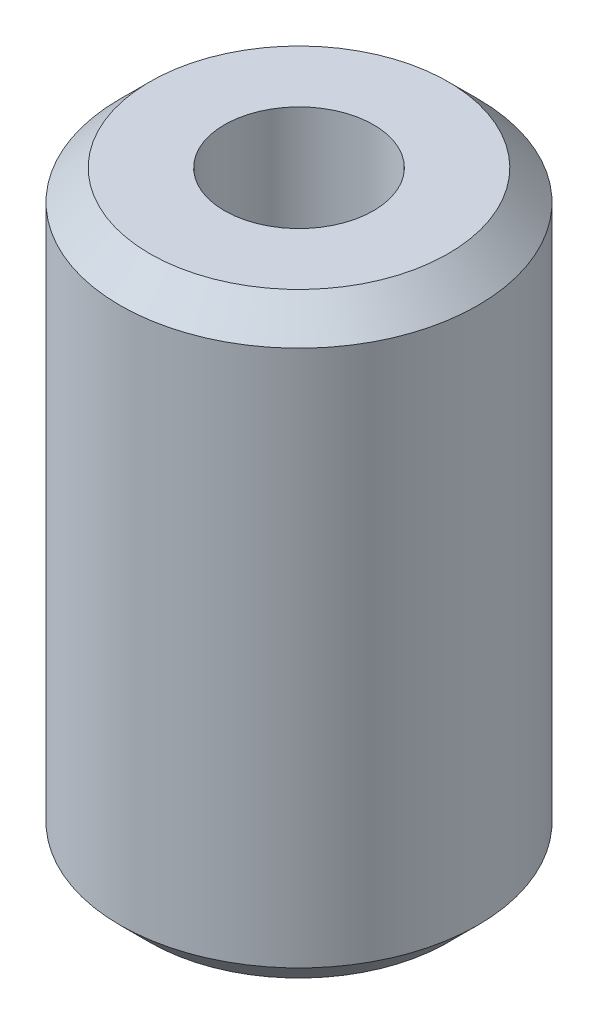
from build123d import *

# Parameters (mm, degrees)
SKETCH1_R             = 3
BOSS_EXTRUDE1_DEPTH   = 10
M3X0_5_TAPPED_HOLE1_D = 2.5
CHAMFER1_SIZE         = 0.5


with BuildPart() as part:
    # Sketch1 → Boss-Extrude1 (new body)
    with BuildSketch(Plane(origin=(0, 0, 0), x_dir=(1, 0, 0), z_dir=(0, 1, 0))):
        with Locations(Location((0, 0, 0), (0, 0, 270))):
            Circle(SKETCH1_R)
    extrude(amount=BOSS_EXTRUDE1_DEPTH)

    # M3x0.5 Tapped Hole1 (through all)
    with Locations(Plane(origin=(0, 10, 0), x_dir=(1, 0, 0), z_dir=(0, 1, 0))):
        with Locations((0, 0)):
            Hole(M3X0_5_TAPPED_HOLE1_D / 2)

    # Chamfer1
    chamfer1_edges = [part.edges().sort_by_distance(p)[0] for p in [
        (0, 0, -3),
        (0, 10, -3),
    ]]
    chamfer(chamfer1_edges, length=CHAMFER1_SIZE)


solid = part.part
